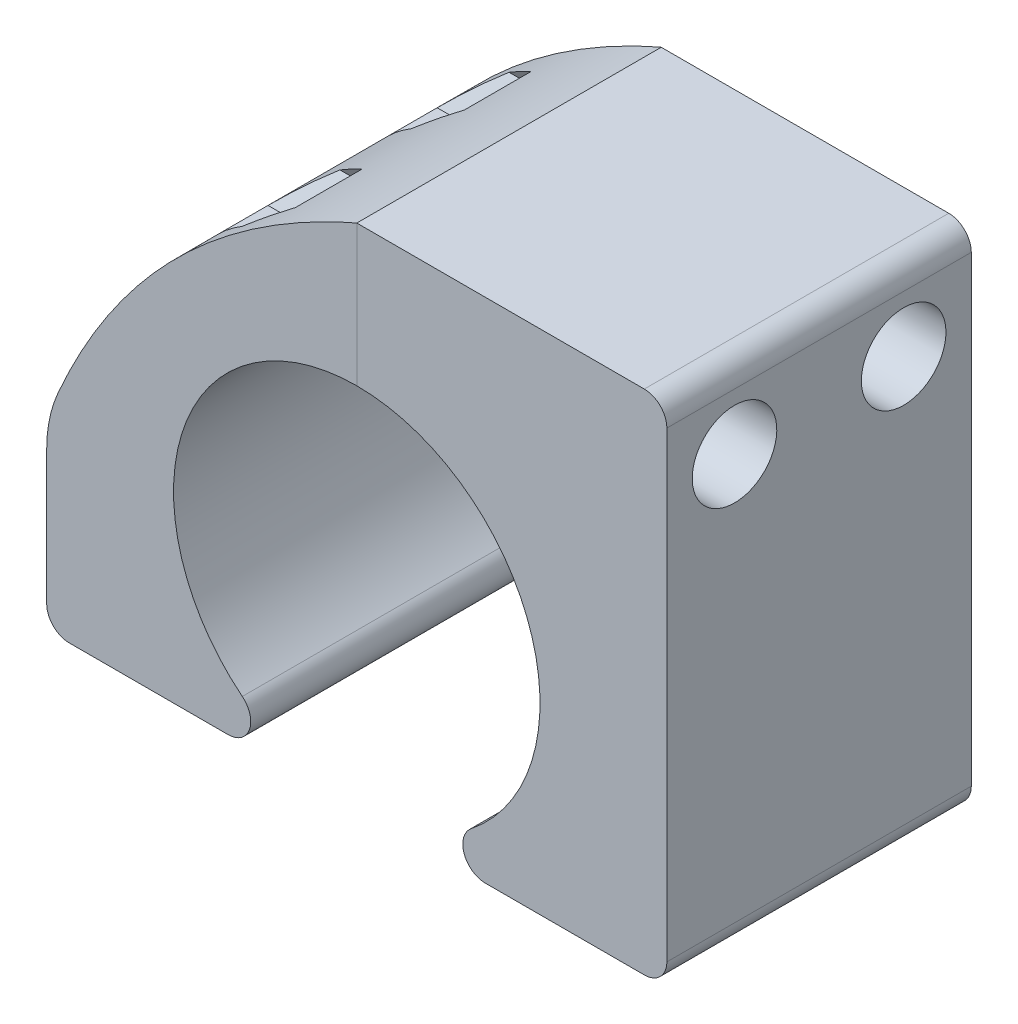
from build123d import *

# Parameters (mm, degrees)
BOSS_EXTRUDE1_DEPTH    = 13.5
FILLET1_R              = 2
SPLIT1_SURFACE_1_BACK  = 77.02
SPLIT1_SURFACE_1_DEPTH = 154.04
SPLIT1_SURFACE_2_BACK  = 77.02
SPLIT1_SURFACE_2_DEPTH = 154.04
SKETCH3_R              = 3.75
CUT_EXTRUDE1_DEPTH     = 12.5
SKETCH7_R              = 2.25
CUT_EXTRUDE3_DEPTH     = 15
CUT_EXTRUDE2_DEPTH     = 27
FILLET2_R              = 12
SKETCH8_R              = 2.25
CUT_EXTRUDE4_DEPTH     = 27.5
CUT_EXTRUDE5_DEPTH     = 19
SKETCH10_R             = 2.25
CUT_EXTRUDE6_DEPTH     = 35
CUT_EXTRUDE7_DEPTH     = 19


with BuildPart() as part:
    # Sketch1 → Boss-Extrude1 (new, symmetric)
    with BuildSketch(Plane.XY):
        with BuildLine():
            Line((11.401754251, -16.25), (27.5, -16.25))
            Line((27.5, -16.25), (27.5, 28.75))
            Line((27.5, 28.75), (-27.5, 28.75))
            Line((-27.5, 28.75), (-27.5, -16.25))
            Line((-27.5, -16.25), (-11.401754251, -16.25))
            ThreePointArc((-11.401754251, -16.25), (-9.514522459, -14.912084711), (-10.152246936, -12.688356164))
            ThreePointArc((-10.152246936, -12.688356164), (0, 16.25), (10.152246936, -12.688356164))
            ThreePointArc((10.152246936, -12.688356164), (9.514522459, -14.912084711), (11.401754251, -16.25))
        make_face()
    extrude(amount=BOSS_EXTRUDE1_DEPTH, both=True)

    # Fillet1
    fillet1_edges = [part.edges().sort_by_distance(p)[0] for p in [
        (27.5, 28.75, 0),
        (27.5, -16.25, 0),
        (-27.5, -16.25, 0),
    ]]
    fillet(fillet1_edges, radius=FILLET1_R)


with BuildPart() as body_2:
    # Split1: the piece behind the surface
    add(part.part)
    # Split1 surface: a surface, the sketch's curves swept straight by 154.04 mm
    with BuildLine(Plane.XY.offset(13.5).offset(-SPLIT1_SURFACE_1_BACK), mode=Mode.PRIVATE) as split1_surface_1_path:
        Line((0, 28.75), (0, 0))
    split1_surface_1 = Shell.extrude(split1_surface_1_path.wire(), (0 * SPLIT1_SURFACE_1_DEPTH, 0 * SPLIT1_SURFACE_1_DEPTH, 1 * SPLIT1_SURFACE_1_DEPTH))
    split(bisect_by=split1_surface_1, keep=Keep.BOTTOM)

    # Sketch6 → Cut-Extrude2 (cut)
    with BuildSketch(Plane.XY.offset(13.5)):
        with BuildLine():
            Line((-27.5, 28.75), (-27.5, 0))
            add(Edge.make_bspline(
                [(0, 28.75), (-19.739323264, 20.184554889), (-27.5, 0)],
                knots=[0, 0, 0, 1, 1, 1], degree=2))
            Line((0, 28.75), (-27.5, 28.75))
        make_face()
    extrude(amount=-CUT_EXTRUDE2_DEPTH, mode=Mode.SUBTRACT)

    # Fillet2
    fillet2_edges = [body_2.edges().sort_by_distance(p)[0] for p in [
        (-27.5, 0, 0),
    ]]
    fillet(fillet2_edges, radius=FILLET2_R)

    # Sketch8 → Cut-Extrude4 (cut)
    with BuildSketch(Plane(origin=(0, 0, 0), x_dir=(0, 0, -1), z_dir=(1, 0, 0))):
        with Locations(Location((7.5, 21.75, 0), (0, 0, 90))):
            Circle(SKETCH8_R)
        with Locations(Location((-7.5, 21.75, 0), (0, 0, 90))):
            Circle(SKETCH8_R)
    extrude(amount=-CUT_EXTRUDE4_DEPTH, mode=Mode.SUBTRACT)

    # Sketch9 → Cut-Extrude5 (cut)
    with BuildSketch(Plane.ZY.offset(27.5)):
        Polygon((-5.334936491, 25.5), (-9.665063509, 25.5), (-11.830127019, 21.75), (-9.665063509, 18), (-5.334936491, 18), (-3.169872981, 21.75), align=None)
        Polygon((3.169872981, 21.75), (5.334936491, 25.5), (9.665063509, 25.5), (11.830127019, 21.75), (9.665063509, 18), (5.334936491, 18), align=None)
    extrude(amount=-CUT_EXTRUDE5_DEPTH, mode=Mode.SUBTRACT)

    # Sketch10 → Cut-Extrude6 (cut)
    with BuildSketch(Plane.XZ.offset(16.25)):
        with Locations((-20, 0)):
            Circle(SKETCH10_R)
    extrude(amount=-CUT_EXTRUDE6_DEPTH, mode=Mode.SUBTRACT)

    # Sketch11 → Cut-Extrude7 (cut)
    with BuildSketch(Plane(origin=(0, 28.75, 0), x_dir=(1, 0, 0), z_dir=(0, 1, 0))):
        Polygon((-16.25, -2.165063509), (-16.25, 2.165063509), (-20, 4.330127019), (-23.75, 2.165063509), (-23.75, -2.165063509), (-20, -4.330127019), align=None)
    extrude(amount=-CUT_EXTRUDE7_DEPTH, mode=Mode.SUBTRACT)


with BuildPart() as part_1:
    add(part.part)

    # Split1: split by a surface, the side it looks to stays
    # Split1 surface: a surface, the sketch's curves swept straight by 154.04 mm
    with BuildLine(Plane.XY.offset(13.5).offset(-SPLIT1_SURFACE_2_BACK), mode=Mode.PRIVATE) as split1_surface_2_path:
        Line((0, 28.75), (0, 0))
    split1_surface_2 = Shell.extrude(split1_surface_2_path.wire(), (0 * SPLIT1_SURFACE_2_DEPTH, 0 * SPLIT1_SURFACE_2_DEPTH, 1 * SPLIT1_SURFACE_2_DEPTH))
    split(bisect_by=split1_surface_2, keep=Keep.TOP)

    # Sketch3 → Cut-Extrude1 (cut)
    with BuildSketch(Plane(origin=(27.5, 0, 0), x_dir=(0, 0, -1), z_dir=(1, 0, 0))):
        with Locations(Location((-7.5, 21.75, 0), (0, 0, 90))):
            Circle(SKETCH3_R)
        with Locations(Location((7.5, 21.75, 0), (0, 0, 180))):
            Circle(SKETCH3_R)
    extrude(amount=-CUT_EXTRUDE1_DEPTH, mode=Mode.SUBTRACT)

    # Sketch7 → Cut-Extrude3 (cut)
    with BuildSketch(Plane(origin=(15, 0, 0), x_dir=(0, 0, -1), z_dir=(1, 0, 0))):
        with Locations((-7.5, 21.75)):
            Circle(SKETCH7_R)
        with Locations(Location((7.5, 21.75, 0), (0, 0, 180))):
            Circle(SKETCH7_R)
    extrude(amount=-CUT_EXTRUDE3_DEPTH, mode=Mode.SUBTRACT)


solid = Compound([body_2.part, part_1.part])
